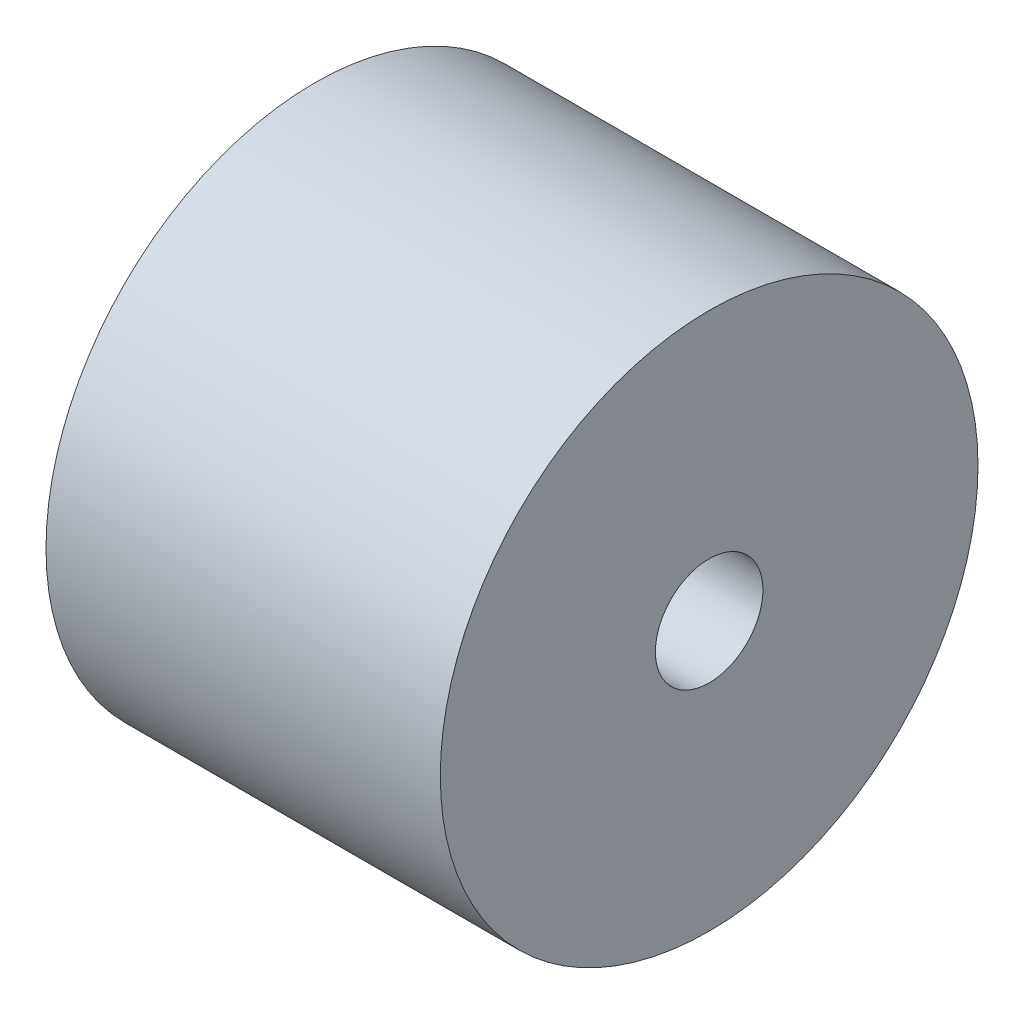
from build123d import *

# Parameters (mm, degrees)
SKIZZE1_W                            = 22
SKIZZE1_H                            = 15
SCHNITT_LINEAR_AUSTRAGEN1_DEPTH      = 31.56141358
SCHNITT_LINEAR_AUSTRAGEN1_DEPTH_BACK = 31.56141358
SKIZZE2_R                            = 3


with BuildPart() as part:
    # Skizze1 → Rotation1 (revolve)
    with BuildSketch(Plane(origin=(0, 0, 0), x_dir=(1, 0, 0), z_dir=(0, 1, 0)), mode=Mode.PRIVATE) as rotation1_sk:
        with Locations((11, 7.5)):
            Rectangle(SKIZZE1_W, SKIZZE1_H)
    revolve(rotation1_sk.sketch.rotate(Axis((-5.372217405, 0, 0), (1, 0, 0)), 180), axis=Axis((-5.372217405, 0, 0), (1, 0, 0)))

    # Skizze2 → Schnitt-Linear austragen1 (cut, two sides: drawn at the far end of the back side and taken through both)
    with BuildSketch(Plane.ZY.offset(-SCHNITT_LINEAR_AUSTRAGEN1_DEPTH_BACK)):
        Circle(SKIZZE2_R)
    extrude(amount=SCHNITT_LINEAR_AUSTRAGEN1_DEPTH + SCHNITT_LINEAR_AUSTRAGEN1_DEPTH_BACK, mode=Mode.SUBTRACT)


solid = part.part
